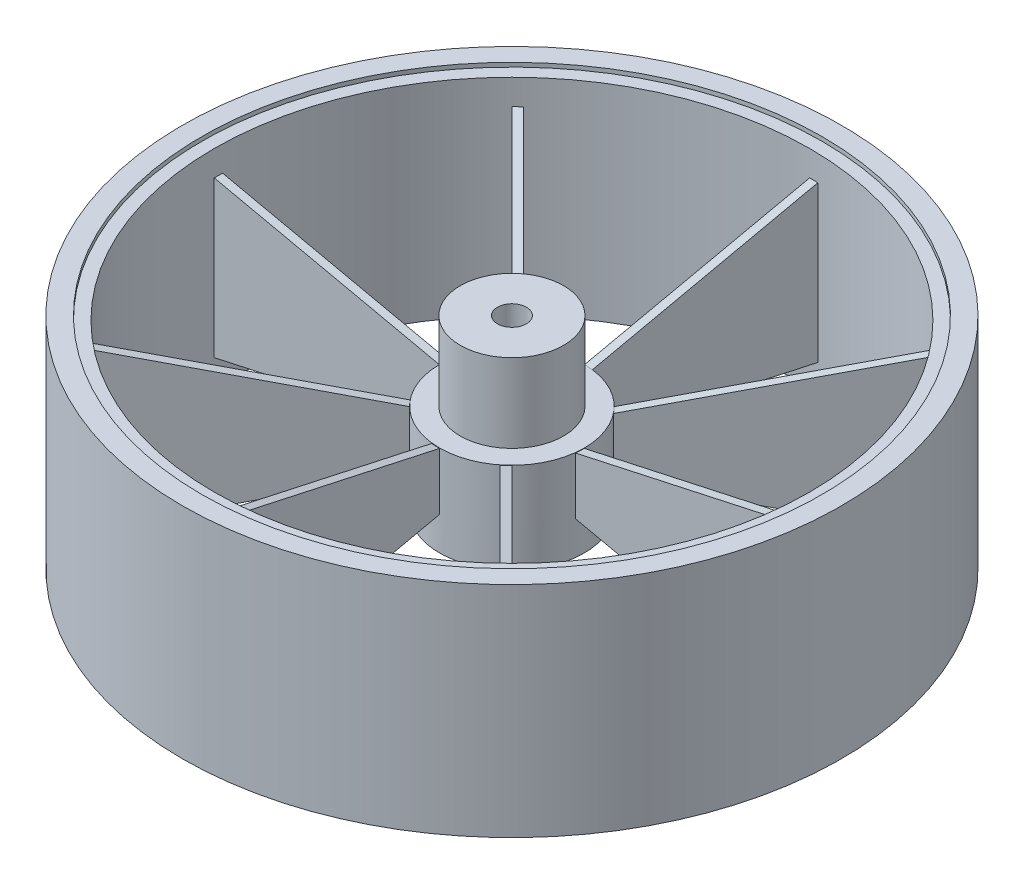
from build123d import *

# Parameters (mm, degrees)
SKETCH1_R                = 17.5
BOSS_EXTRUDE1_DEPTH      = 50
SKETCH1_R_2              = 75
SKETCH1_R_3              = 72
BOSS_EXTRUDE1_2_DEPTH    = 50
SKETCH2_R                = 17.5
CUT_EXTRUDE1_DEPTH       = 10
BOSS_EXTRUDE2_DEPTH      = 2
CIRPATTERN1_COUNT        = 8
CUT_EXTRUDE2_START       = -8
SKETCH4_R                = 17.5
CUT_EXTRUDE2_DEPTH       = 8
SKETCH6_R                = 12.5
BOSS_EXTRUDE3_DEPTH      = 19
SKETCH7_R                = 3.5
CUT_EXTRUDE3_DEPTH       = 42
CUT_EXTRUDE4_DEPTH       = 3
CUT_EXTRUDE4_DEPTH_BACK  = 18
SKETCH8_R                = 2
BOSS_EXTRUDE4_DEPTH      = 51
BOSS_EXTRUDE4_DEPTH_BACK = 2
SKETCH9_R                = 79.710570968
SKETCH9_R_2              = 75


with BuildPart() as part:
    # Sketch1 → Boss-Extrude1 (new body)
    with BuildSketch(Plane(origin=(0, 0, 0), x_dir=(1, 0, 0), z_dir=(0, 1, 0))):
        with Locations(Location((0, 0, 0), (0, 0, 270))):
            Circle(SKETCH1_R)
    extrude(amount=BOSS_EXTRUDE1_DEPTH)

    # Sketch2 → Cut-Extrude1 (cut)
    with BuildSketch(Plane.XZ):
        with Locations(Location((0, 0, 0), (0, 0, 270))):
            Circle(SKETCH2_R)
    cut_extrude1 = extrude(amount=-CUT_EXTRUDE1_DEPTH, mode=Mode.SUBTRACT)

    # Mirror1: Cut-Extrude1 across plane
    add(cut_extrude1.mirror(Plane.ZX.offset(25)), mode=Mode.SUBTRACT)

    # Sketch4 → Cut-Extrude2 (cut)
    with BuildSketch(Plane(origin=(0, 40, 0), x_dir=(1, 0, 0), z_dir=(0, 1, 0)).offset(CUT_EXTRUDE2_START)):
        with Locations(Location((0, 0, 0), (0, 0, 90))):
            Circle(SKETCH4_R)
    extrude(amount=CUT_EXTRUDE2_DEPTH, mode=Mode.SUBTRACT)


with BuildPart() as body_2:
    # Sketch1 → Boss-Extrude1 2 (new body)
    with BuildSketch(Plane(origin=(0, 0, 0), x_dir=(1, 0, 0), z_dir=(0, 1, 0))):
        with Locations(Location((0, 0, 0), (0, 0, 270))):
            Circle(SKETCH1_R_2)
        with Locations(Location((0, 0, 0), (0, 0, 270))):
            Circle(SKETCH1_R_3, mode=Mode.SUBTRACT)
    extrude(amount=BOSS_EXTRUDE1_2_DEPTH)

    # Sketch3 → Boss-Extrude2 (add)
    with BuildSketch(Plane(origin=(0, 0, 0), x_dir=(0, 0, -1), z_dir=(1, 0, 0))):
        Polygon((16.718472528, 18.253836478), (16.718472528, 31.749663618), (73.745525638, 44.207029589), (73.745525638, 5.796470507), align=None)
    boss_extrude2 = extrude(amount=BOSS_EXTRUDE2_DEPTH)

    # CirPattern1: Boss-Extrude2 ×8 about axis
    cirpattern1_axis = Axis((0, 0, 0), (0, 1, 0))
    for i in range(1, CIRPATTERN1_COUNT):
        add(boss_extrude2.rotate(cirpattern1_axis, i * 360 / CIRPATTERN1_COUNT))


    add(part.part)  # Boss-Extrude3 merges part
    # Sketch6 → Boss-Extrude3 (add)
    with BuildSketch(Plane(origin=(0, 32, 0), x_dir=(1, 0, 0), z_dir=(0, 1, 0))):
        with Locations(Location((0, 0, 0), (0, 0, 270))):
            Circle(SKETCH6_R)
    extrude(amount=BOSS_EXTRUDE3_DEPTH)

    # Sketch7 → Cut-Extrude3 (cut)
    with BuildSketch(Plane(origin=(0, 51, 0), x_dir=(1, 0, 0), z_dir=(0, 1, 0))):
        with Locations(Location((0, 0, 0), (0, 0, 270))):
            Circle(SKETCH7_R)
    extrude(amount=-CUT_EXTRUDE3_DEPTH, mode=Mode.SUBTRACT)

    # Sketch8 → Cut-Extrude4 (cut, two sides: drawn at the far end of the back side and taken through both)
    with BuildSketch(Plane(origin=(0, 0, 0), x_dir=(0, 0, -1), z_dir=(1, 0, 0)).offset(-CUT_EXTRUDE4_DEPTH_BACK)):
        with Locations(Location((0, 41.737851991, 0), (0, 0, 180))):
            Circle(SKETCH8_R)
    extrude(amount=CUT_EXTRUDE4_DEPTH + CUT_EXTRUDE4_DEPTH_BACK, mode=Mode.SUBTRACT)

    # Sketch9 → Boss-Extrude4 (add, two sides: drawn at the far end of the back side and taken through both)
    with BuildSketch(Plane(origin=(0, 0, 0), x_dir=(1, 0, 0), z_dir=(0, 1, 0)).offset(-BOSS_EXTRUDE4_DEPTH_BACK)):
        with Locations(Location((0, 0, 0), (0, 0, 270))):
            Circle(SKETCH9_R)
        with Locations(Location((0, 0, 0), (0, 0, 270))):
            Circle(SKETCH9_R_2, mode=Mode.SUBTRACT)
    extrude(amount=BOSS_EXTRUDE4_DEPTH + BOSS_EXTRUDE4_DEPTH_BACK)


solid = body_2.part
